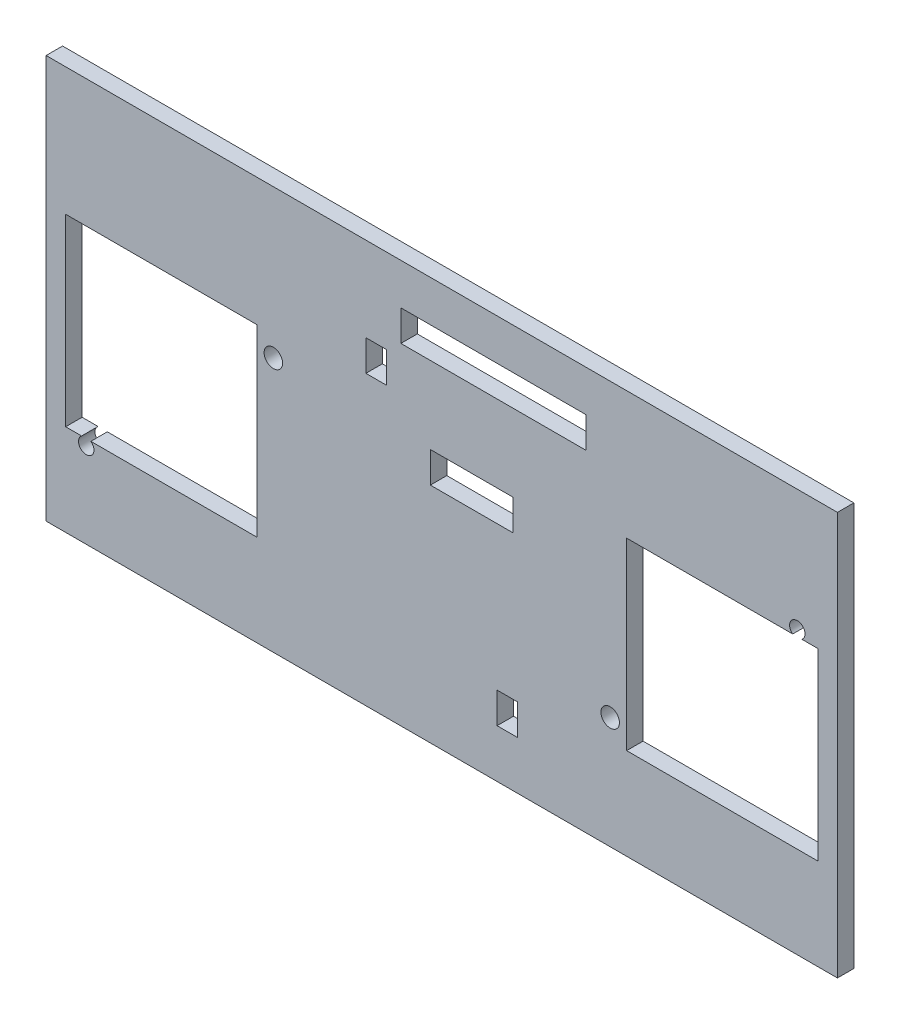
from build123d import *

# Parameters (mm, degrees)
SKETCH_1_W          = 76.96
SKETCH_1_H          = 39.22
SKETCH_1_R          = 0.9
SKETCH_1_W_2        = 18
SKETCH_1_H_2        = 3
SKETCH_1_W_3        = 18.6
SKETCH_1_H_3        = 17.9
EXTRUDE_1_DEPTH     = 1.6
SKETCH_2_R          = 0.75
CUT_EXTRUDE_1_DEPTH = 1.6
SKETCH_3_W          = 2
SKETCH_3_H          = 3
CUT_EXTRUDE_2_DEPTH = 1.6
SKETCH_5_W          = 8.05
SKETCH_5_H          = 3
CUT_EXTRUDE_3_DEPTH = 10


with BuildPart() as part:
    # 草图1 → 凸台-拉伸1 (new body)
    with BuildSketch(Plane.XY):
        with Locations((0, 1)):
            Rectangle(SKETCH_1_W, SKETCH_1_H)
        with Locations((-16.38, 6.19)):
            Circle(SKETCH_1_R, mode=Mode.SUBTRACT)
        with Locations((16.38, -7.71)):
            Circle(SKETCH_1_R, mode=Mode.SUBTRACT)
        with Locations((5.02, 15.11)):
            Rectangle(SKETCH_1_W_2, SKETCH_1_H_2, mode=Mode.SUBTRACT)
        with Locations((-27.28, -0.76)):
            Rectangle(SKETCH_1_W_3, SKETCH_1_H_3, mode=Mode.SUBTRACT)
        with Locations((27.28, -0.76)):
            Rectangle(SKETCH_1_W_3, SKETCH_1_H_3, mode=Mode.SUBTRACT)
    extrude(amount=EXTRUDE_1_DEPTH)

    # 草图2 → 切除-拉伸1 (cut)
    with BuildSketch(Plane.XY.offset(1.6)):
        with Locations((34.58, 8.79)):
            Circle(SKETCH_2_R)
        with Locations((-34.58, -10.31)):
            Circle(SKETCH_2_R)
    extrude(amount=-CUT_EXTRUDE_1_DEPTH, mode=Mode.SUBTRACT)

    # 草图3 → 切除-拉伸2 (cut)
    with BuildSketch(Plane.XY.offset(1.6)):
        with Locations((6.38, -12.41)):
            Rectangle(SKETCH_3_W, SKETCH_3_H)
        with Locations((-6.38, 10.89)):
            Rectangle(SKETCH_3_W, SKETCH_3_H)
    extrude(amount=-CUT_EXTRUDE_2_DEPTH, mode=Mode.SUBTRACT)

    # 草图5 → 切除-拉伸3 (cut)
    with BuildSketch(Plane.XY.offset(1.6)):
        with Locations((2.915, 4.61)):
            Rectangle(SKETCH_5_W, SKETCH_5_H)
    extrude(amount=-CUT_EXTRUDE_3_DEPTH, mode=Mode.SUBTRACT)


solid = part.part
